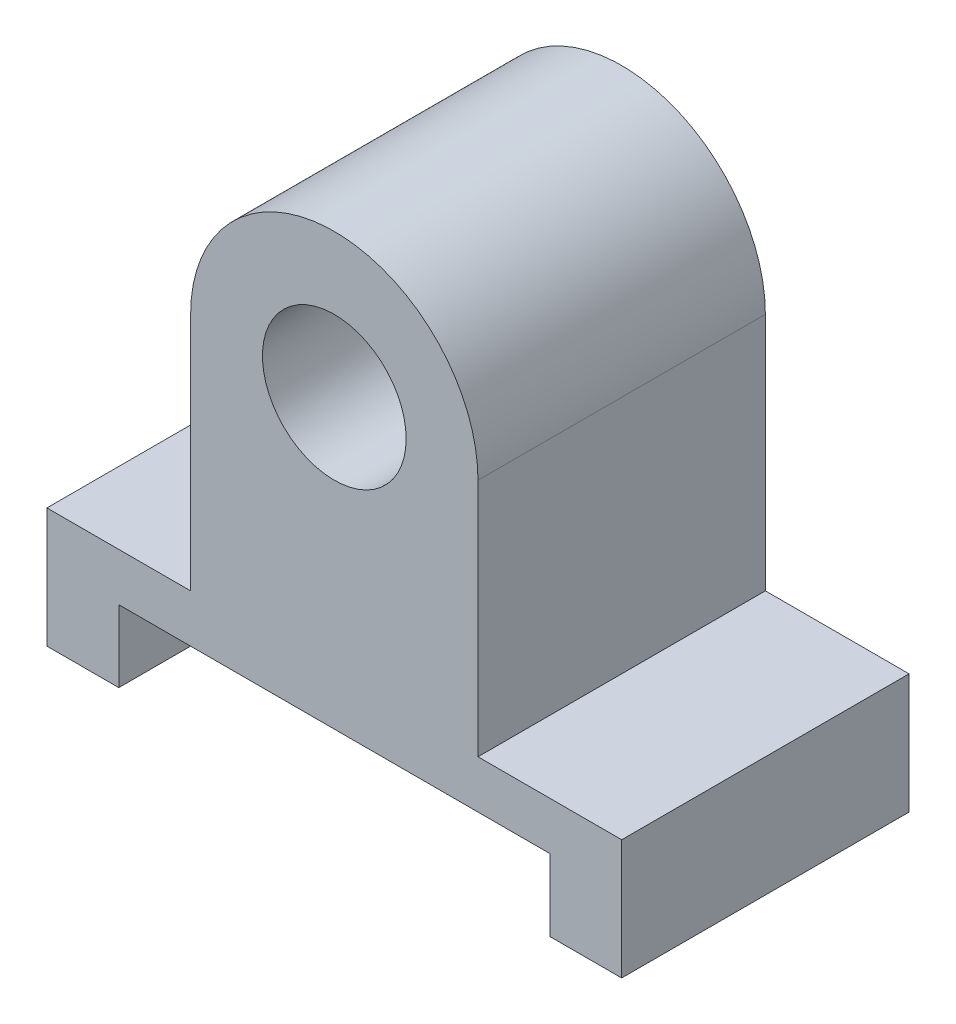
from build123d import *

# Parameters (mm, degrees)
SKETCH1_R           = 15
BOSS_EXTRUDE2_DEPTH = 60


with BuildPart() as part:
    # Sketch1 → Boss-Extrude2 (new body)
    # profile 1 of 2: a face of its own
    with BuildSketch(Plane.XY):
        with BuildLine():
            Line((-12.60240546, 38.711870299), (-12.60240546, -11.288129701))
            Line((-12.60240546, -11.288129701), (47.39759454, -11.288129701))
            Line((47.39759454, -11.288129701), (47.39759454, 38.711870299))
            ThreePointArc((47.39759454, 38.711870299), (17.39759454, 68.711870299), (-12.60240546, 38.711870299))
        make_face()
        with Locations((17.39759454, 38.711870299)):
            Circle(SKETCH1_R, mode=Mode.SUBTRACT)
    # profile 2 of 2: a face of its own
    with BuildSketch(Plane.XY):
        Polygon((-42.60240546, -11.288129701), (77.39759454, -11.288129701), (77.39759454, -36.288129701), (62.39759454, -36.288129701), (62.39759454, -21.288129701), (-27.60240546, -21.288129701), (-27.60240546, -36.288129701), (-42.60240546, -36.288129701), align=None)
    extrude(amount=BOSS_EXTRUDE2_DEPTH)


solid = part.part
